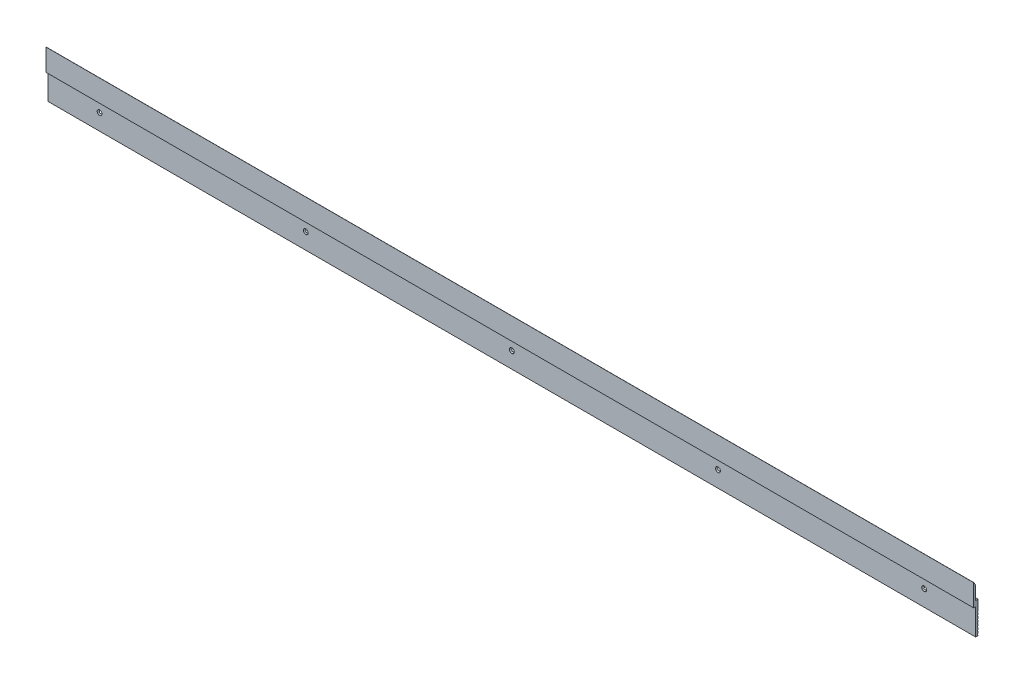
from build123d import *

# Parameters (mm, degrees)
SKETCH1_W            = 2.032
SKETCH1_H            = 21.59
EXTRUDE_THIN1_DEPTH  = 457.2
SKETCH2_W            = 2.286
SKETCH2_H            = 31.242
EXTRUDE_THIN2_DEPTH  = 457.2
CHAMFER1_SIZE        = 3.302
CHAMFER1_SIZE2       = 1.906410589
SKETCH3_R            = 2.3876
CUT_EXTRUDE1_DEPTH   = 2.286
LPATTERN2_COUNT      = 5
LPATTERN2_PITCH      = 203.2
LPATTERN2_COUNT_DIR2 = 5
LPATTERN2_PITCH_DIR2 = 203.2
SKETCH4_R            = 0.635
CUT_EXTRUDE2_DEPTH   = 915.93641766
LPATTERN1_COUNT      = 7
LPATTERN1_PITCH      = 3.175


with BuildPart() as part:
    # Sketch1 → Extrude-Thin1 (new, symmetric)
    with BuildSketch(Plane(origin=(0, 0, 0), x_dir=(0, 0, -1), z_dir=(1, 0, 0))):
        with Locations((-1.016, 5.461)):
            Rectangle(SKETCH1_W, SKETCH1_H)
    extrude(amount=EXTRUDE_THIN1_DEPTH, both=True)

    # Sketch2 → Extrude-Thin2 (add, symmetric)
    with BuildSketch(Plane(origin=(0, 0, 0), x_dir=(0, 0, -1), z_dir=(1, 0, 0))):
        with Locations((1.143, -15.621)):
            Rectangle(SKETCH2_W, SKETCH2_H)
    extrude(amount=EXTRUDE_THIN2_DEPTH, both=True)

    # Chamfer1
    chamfer1_edges = [part.edges().sort_by_distance(p)[0] for p in [
        (0, 16.256, 0),
    ]]
    chamfer1_side = [part.faces().sort_by_distance(p)[0] for p in [
        (0, 8.128, 0),
    ]]
    chamfer(chamfer1_edges, length=CHAMFER1_SIZE, length2=CHAMFER1_SIZE2, reference=chamfer1_side[0])

    # Sketch3 → Cut-Extrude1 (cut)
    with BuildSketch(Plane(origin=(0, 0, -2.286), x_dir=(-1, 0, 0), z_dir=(0, 0, -1))):
        with Locations((0, -15.367)):
            Circle(SKETCH3_R)
    cut_extrude1 = extrude(amount=-CUT_EXTRUDE1_DEPTH, mode=Mode.SUBTRACT)

    # LPattern2: Cut-Extrude1 5 × 5
    with Locations(*[Vector(-1, 0, 0) * (i * LPATTERN2_PITCH) + Vector(1, 0, 0) * (j * LPATTERN2_PITCH_DIR2) for i in range(LPATTERN2_COUNT) for j in range(LPATTERN2_COUNT_DIR2) if (i, j) != (0, 0)]):
        add(cut_extrude1, mode=Mode.SUBTRACT)

    # Sketch4 → Cut-Extrude2 (cut, through all)
    with BuildSketch(Plane(origin=(457.2, 0, 0), x_dir=(0, 0, -1), z_dir=(1, 0, 0))):
        with Locations((2.286, -29.972)):
            Circle(SKETCH4_R)
    cut_extrude2 = extrude(amount=-CUT_EXTRUDE2_DEPTH, mode=Mode.SUBTRACT)

    # LPattern1: Cut-Extrude2 ×7
    with Locations(*[(0, i * LPATTERN1_PITCH, 0) for i in range(1, LPATTERN1_COUNT)]):
        add(cut_extrude2, mode=Mode.SUBTRACT)


solid = part.part
